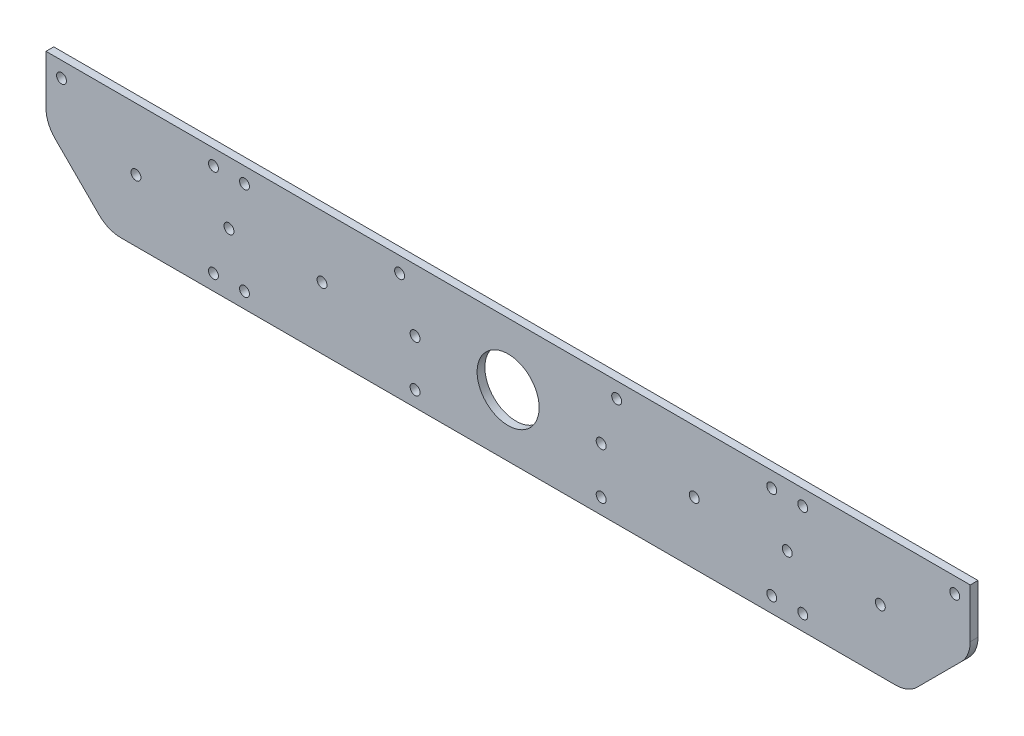
from build123d import *

# Parameters (mm, degrees)
SKETCH1_W           = 378.46
SKETCH1_H           = 50.8
SKETCH1_R           = 2.032
BOSS_EXTRUDE1_DEPTH = 3.175
SKETCH2_R           = 12.7
CUT_EXTRUDE1_DEPTH  = 191.953485239
SKETCH3_R           = 2.032
CUT_EXTRUDE2_DEPTH  = 191.953485239
SKETCH4_R           = 2.032
CUT_EXTRUDE3_DEPTH  = 191.953485239
SKETCH6_R           = 2.032
CUT_EXTRUDE5_DEPTH  = 191.953485239
CUT_EXTRUDE6_DEPTH  = 191.953485239
FILLET1_R           = 12.7


with BuildPart() as part:
    # Sketch1 → Boss-Extrude1 (new body)
    with BuildSketch(Plane.XY):
        Rectangle(SKETCH1_W, SKETCH1_H)
        Circle(SKETCH1_R, mode=Mode.SUBTRACT)
        with Locations((-38.1, 0)):
            Circle(SKETCH1_R, mode=Mode.SUBTRACT)
        with Locations((-76.2, 0)):
            Circle(SKETCH1_R, mode=Mode.SUBTRACT)
        with Locations((-114.3, 0)):
            Circle(SKETCH1_R, mode=Mode.SUBTRACT)
        with Locations((-152.4, 0)):
            Circle(SKETCH1_R, mode=Mode.SUBTRACT)
        with Locations(Location((76.2, 0, 0), (0, 0, 180))):
            Circle(SKETCH1_R, mode=Mode.SUBTRACT)
        with Locations(Location((114.3, 0, 0), (0, 0, 180))):
            Circle(SKETCH1_R, mode=Mode.SUBTRACT)
        with Locations(Location((152.4, 0, 0), (0, 0, 180))):
            Circle(SKETCH1_R, mode=Mode.SUBTRACT)
        with Locations(Location((38.1, 0, 0), (0, 0, 180))):
            Circle(SKETCH1_R, mode=Mode.SUBTRACT)
    extrude(amount=BOSS_EXTRUDE1_DEPTH)

    # Sketch2 → Cut-Extrude1 (cut, through all)
    with BuildSketch(Plane.XY.offset(3.175)):
        Circle(SKETCH2_R)
    extrude(amount=-CUT_EXTRUDE1_DEPTH, mode=Mode.SUBTRACT)

    # Sketch3 → Cut-Extrude2 (cut, through all)
    with BuildSketch(Plane.XY.offset(3.175)):
        with Locations((-38.1, -19.05)):
            Circle(SKETCH3_R)
        with Locations((-44.45, 19.05)):
            Circle(SKETCH3_R)
        with Locations((44.45, 19.05)):
            Circle(SKETCH3_R)
        with Locations((38.1, -19.05)):
            Circle(SKETCH3_R)
    extrude(amount=-CUT_EXTRUDE2_DEPTH, mode=Mode.SUBTRACT)

    # Sketch4 → Cut-Extrude3 (cut, through all)
    with BuildSketch(Plane.XY.offset(3.175)):
        with Locations((-107.95, -19.05)):
            Circle(SKETCH4_R)
        with Locations((-120.65, -19.05)):
            Circle(SKETCH4_R)
        with Locations((-120.65, 19.05)):
            Circle(SKETCH4_R)
        with Locations((-107.95, 19.05)):
            Circle(SKETCH4_R)
    cut_extrude3 = extrude(amount=-CUT_EXTRUDE3_DEPTH, mode=Mode.SUBTRACT)

    # Sketch6 → Cut-Extrude5 (cut, through all)
    with BuildSketch(Plane.XY.offset(3.175)):
        with Locations((-182.88, 19.05)):
            Circle(SKETCH6_R)
        with Locations((-182.88, -19.05)):
            Circle(SKETCH6_R)
    cut_extrude5 = extrude(amount=-CUT_EXTRUDE5_DEPTH, mode=Mode.SUBTRACT)

    # Mirror1: Cut-Extrude3, Cut-Extrude5 across plane
    add(cut_extrude3.mirror(Plane(origin=(0, 0, 0), x_dir=(0, 0, 1), z_dir=(1, 0, 0))), mode=Mode.SUBTRACT)
    add(cut_extrude5.mirror(Plane(origin=(0, 0, 0), x_dir=(0, 0, 1), z_dir=(1, 0, 0))), mode=Mode.SUBTRACT)

    # Sketch7 → Cut-Extrude6 (cut, through all)
    with BuildSketch(Plane.XY.offset(3.175)):
        Polygon((-189.23, 0), (-163.83, -25.4), (-189.23, -25.4), align=None)
        Polygon((189.23, -25.4), (189.23, 0), (163.83, -25.4), align=None)
    extrude(amount=-CUT_EXTRUDE6_DEPTH, mode=Mode.SUBTRACT)

    # Fillet1
    fillet1_edges = [part.edges().sort_by_distance(p)[0] for p in [
        (-189.23, 0, 1.5875),
        (-163.83, -25.4, 1.5875),
        (163.83, -25.4, 1.5875),
        (189.23, 0, 1.5875),
    ]]
    fillet(fillet1_edges, radius=FILLET1_R)


solid = part.part
